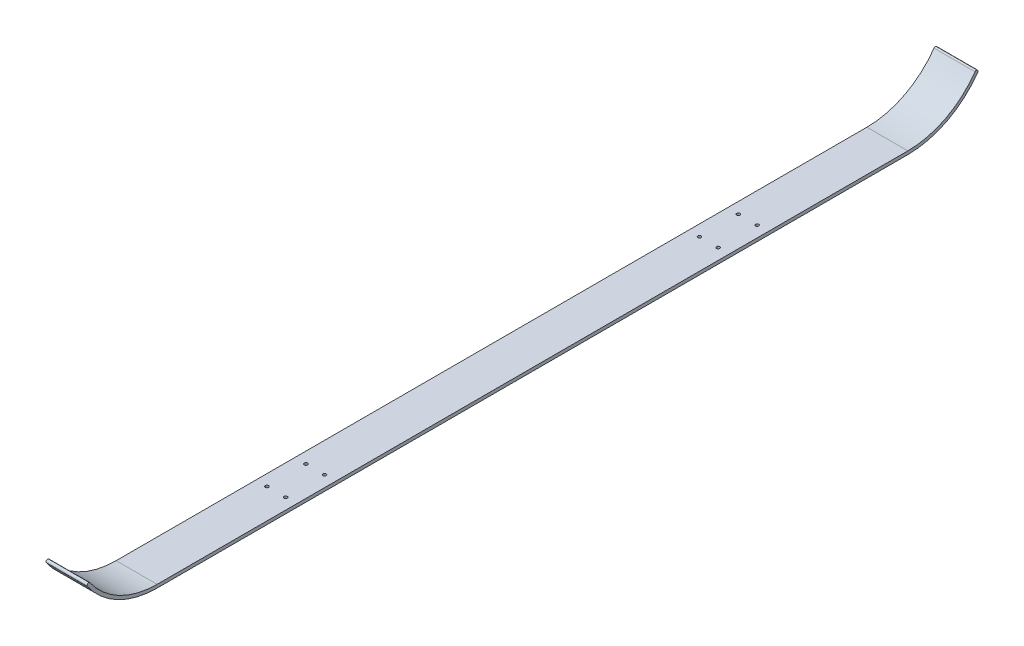
from build123d import *

# Parameters (mm, degrees)
SKETCH1_W           = 150
SKETCH1_H           = 2548
SKETCH1_R           = 6
BOSS_EXTRUDE1_DEPTH = 12
BOSS_EXTRUDE2_DEPTH = 150


with BuildPart() as part:
    # Sketch1 → Boss-Extrude1 (new body)
    with BuildSketch(Plane(origin=(0, 0, 0), x_dir=(1, 0, 0), z_dir=(0, 1, 0))):
        Rectangle(SKETCH1_W, SKETCH1_H)
        with Locations(Location((-34.25, 720.25, 0), (0, 0, 270))):
            Circle(SKETCH1_R, mode=Mode.SUBTRACT)
        with Locations(Location((34.25, 720.25, 0), (0, 0, 270))):
            Circle(SKETCH1_R, mode=Mode.SUBTRACT)
        with Locations(Location((-34.25, 862.75, 0), (0, 0, 270))):
            Circle(SKETCH1_R, mode=Mode.SUBTRACT)
        with Locations(Location((34.25, 862.75, 0), (0, 0, 270))):
            Circle(SKETCH1_R, mode=Mode.SUBTRACT)
        with Locations(Location((34.25, -720.25, 0), (0, 0, 90))):
            Circle(SKETCH1_R, mode=Mode.SUBTRACT)
        with Locations(Location((-34.25, -720.25, 0), (0, 0, 90))):
            Circle(SKETCH1_R, mode=Mode.SUBTRACT)
        with Locations(Location((34.25, -862.75, 0), (0, 0, 90))):
            Circle(SKETCH1_R, mode=Mode.SUBTRACT)
        with Locations(Location((-34.25, -862.75, 0), (0, 0, 90))):
            Circle(SKETCH1_R, mode=Mode.SUBTRACT)
    extrude(amount=BOSS_EXTRUDE1_DEPTH)

    # Sketch2 → Boss-Extrude2 (add)
    with BuildSketch(Plane(origin=(75, 0, 0), x_dir=(0, 0, -1), z_dir=(1, 0, 0))):
        with BuildLine():
            Line((-1274, 0), (-1374, 0))
            ThreePointArc((-1374, 0), (-1518.065567329, 35.252620048), (-1629.575437818, 133.044151858))
            ThreePointArc((-1629.575437818, 133.044151858), (-1628.101984171, 141.400522742), (-1619.745613287, 139.927069095))
            ThreePointArc((-1619.745613287, 139.927069095), (-1512.524583971, 45.896750047), (-1374, 12))
            Line((-1374, 12), (-1274, 12))
            Line((-1274, 12), (-1274, 0))
        make_face()
        with BuildLine():
            Line((1274, 12), (1374, 12))
            ThreePointArc((1374, 12), (1512.524583971, 45.896750047), (1619.745613287, 139.927069095))
            ThreePointArc((1619.745613287, 139.927069095), (1628.101984171, 141.400522742), (1629.575437818, 133.044151858))
            ThreePointArc((1629.575437818, 133.044151858), (1518.065567329, 35.252620048), (1374, 0))
            Line((1374, 0), (1274, 0))
            Line((1274, 0), (1274, 12))
        make_face()
    extrude(amount=-BOSS_EXTRUDE2_DEPTH)


solid = part.part
